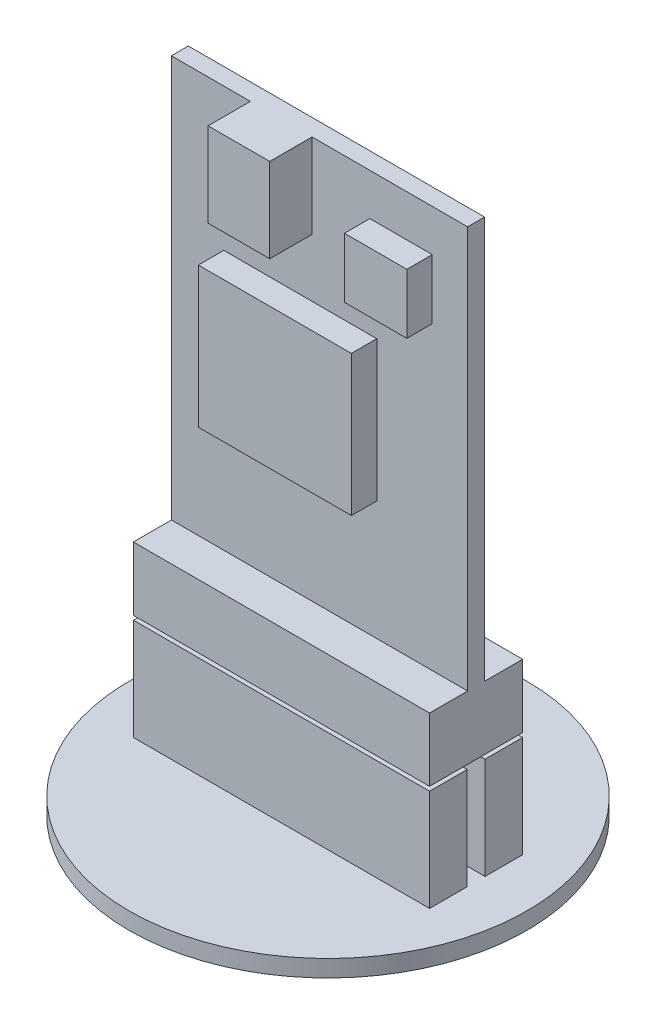
from build123d import *

# Parameters (mm, degrees)
SKETCH1_W                = 14
SKETCH1_H                = 22
BOSS_EXTRUDE1_DEPTH      = 0.8
BOSS_EXTRUDE2_DEPTH      = 1.8
BOSS_EXTRUDE2_DEPTH_BACK = 2.6
SKETCH2_W                = 14
SKETCH2_H                = 3
SKETCH3_W                = 2.913396267
SKETCH3_H                = 3.984974105
BOSS_EXTRUDE3_DEPTH      = 2
SKETCH4_W                = 7.231858128
SKETCH4_H                = 6.637739472
SKETCH4_W_2              = 2.950106431
SKETCH4_H_2              = 2.82718533
BOSS_EXTRUDE4_DEPTH      = 1.2
BOSS_EXTRUDE5_START      = 0.2
SKETCH5_W                = 14
SKETCH5_H                = 1.78
BOSS_EXTRUDE5_DEPTH      = 4.8
BOSS_EXTRUDE5_2_DEPTH    = 4.8
SKETCH6_R                = 9.4
BOSS_EXTRUDE6_DEPTH      = 0.8


with BuildPart() as part:
    # Sketch1 → Boss-Extrude1 (new body)
    with BuildSketch(Plane.XY):
        Rectangle(SKETCH1_W, SKETCH1_H)
    extrude(amount=BOSS_EXTRUDE1_DEPTH)

    # Sketch2 → Boss-Extrude2 (add, two sides: drawn at the far end of the back side and taken through both)
    with BuildSketch(Plane.XY.offset(0.8).offset(-BOSS_EXTRUDE2_DEPTH_BACK)):
        with Locations((0, -9.5)):
            Rectangle(SKETCH2_W, SKETCH2_H)
    extrude(amount=BOSS_EXTRUDE2_DEPTH + BOSS_EXTRUDE2_DEPTH_BACK)

    # Sketch3 → Boss-Extrude3 (add)
    with BuildSketch(Plane.XY.offset(0.8)):
        with Locations((-1.810292651, 9.007512948)):
            Rectangle(SKETCH3_W, SKETCH3_H)
    extrude(amount=BOSS_EXTRUDE3_DEPTH)

    # Sketch4 → Boss-Extrude4 (add)
    with BuildSketch(Plane.XY.offset(0.8)):
        with Locations((-0.911664835, 0.952638535)):
            Rectangle(SKETCH4_W, SKETCH4_H)
        with Locations((3.851527842, 7.610864857)):
            Rectangle(SKETCH4_W_2, SKETCH4_H_2)
    extrude(amount=BOSS_EXTRUDE4_DEPTH)


with BuildPart() as body_2:
    # Sketch5 → Boss-Extrude5 (new body)
    with BuildSketch(Plane.XZ.offset(11).offset(BOSS_EXTRUDE5_START)):
        with Locations((0, 1.71)):
            Rectangle(SKETCH5_W, SKETCH5_H)
    extrude(amount=BOSS_EXTRUDE5_DEPTH)



with BuildPart() as body_3:
    # Sketch5 → Boss-Extrude5 2 (new body)
    with BuildSketch(Plane.XZ.offset(11).offset(BOSS_EXTRUDE5_START)):
        with Locations((0, -0.91)):
            Rectangle(SKETCH5_W, SKETCH5_H)
    extrude(amount=BOSS_EXTRUDE5_2_DEPTH)


with BuildPart() as body_2_1:
    add(body_2.part)

    add(body_3.part)  # Boss-Extrude6 merges body 3
    # Sketch6 → Boss-Extrude6 (add)
    with BuildSketch(Plane.XZ.offset(16)):
        with Locations(Location((0, 0.4, 0), (0, 0, 270))):
            Circle(SKETCH6_R)
    extrude(amount=BOSS_EXTRUDE6_DEPTH)


solid = Compound([part.part, body_2_1.part])
